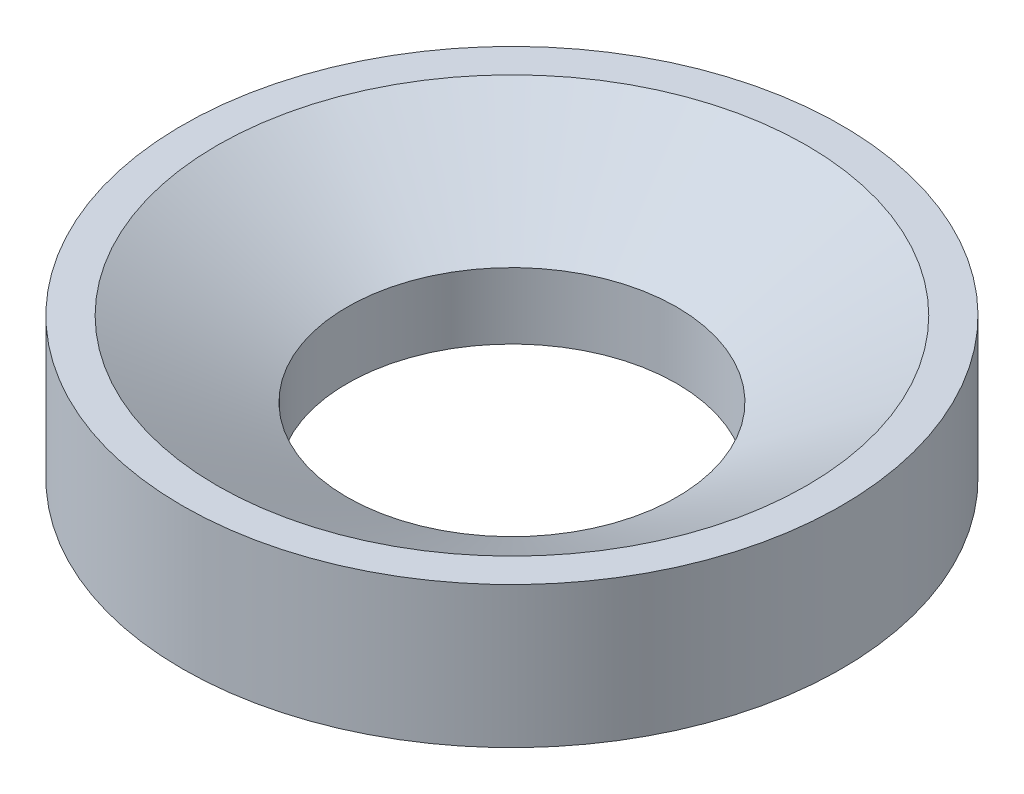
from build123d import *


with BuildPart() as part:
    # Sketch2 → Revolve1 (revolve)
    with BuildSketch(Plane.XY, mode=Mode.PRIVATE) as revolve1_sk:
        Polygon((79.507616708, 38.1), (88.9, 38.1), (88.9, 0), (44.45, 0), (44.45, 17.859475557), align=None)
    revolve(revolve1_sk.sketch.rotate(Axis((0, 44.668427518, 0), (0, -1, 0)), 90), axis=Axis((0, 44.668427518, 0), (0, -1, 0)))


solid = part.part
